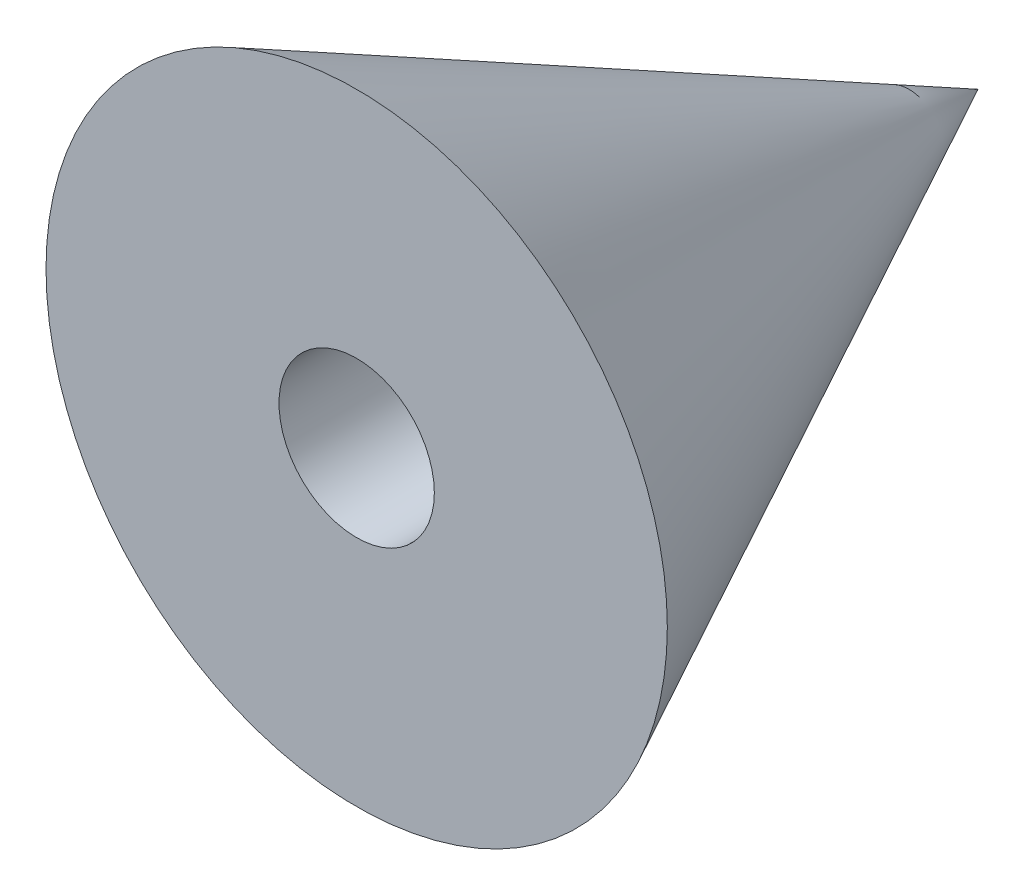
from build123d import *

# Parameters (mm, degrees)
SKETCH3_R          = 2.5
CUT_EXTRUDE2_DEPTH = 5


with BuildPart() as part:
    # Sketch2 → Revolve1 (revolve)
    with BuildSketch(Plane(origin=(0, 0, 0), x_dir=(1, 0, 0), z_dir=(0, 1, 0)), mode=Mode.PRIVATE) as revolve1_sk:
        Polygon((0, 0), (-10, 0), (0, 20), align=None)
    revolve(revolve1_sk.sketch.rotate(Axis((0, 0, -20), (0, 0, 1)), 180), axis=Axis((0, 0, -20), (0, 0, 1)))

    # Sketch3 → Cut-Extrude2 (cut)
    with BuildSketch(Plane.XY):
        Circle(SKETCH3_R)
    extrude(amount=-CUT_EXTRUDE2_DEPTH, mode=Mode.SUBTRACT)


solid = part.part
